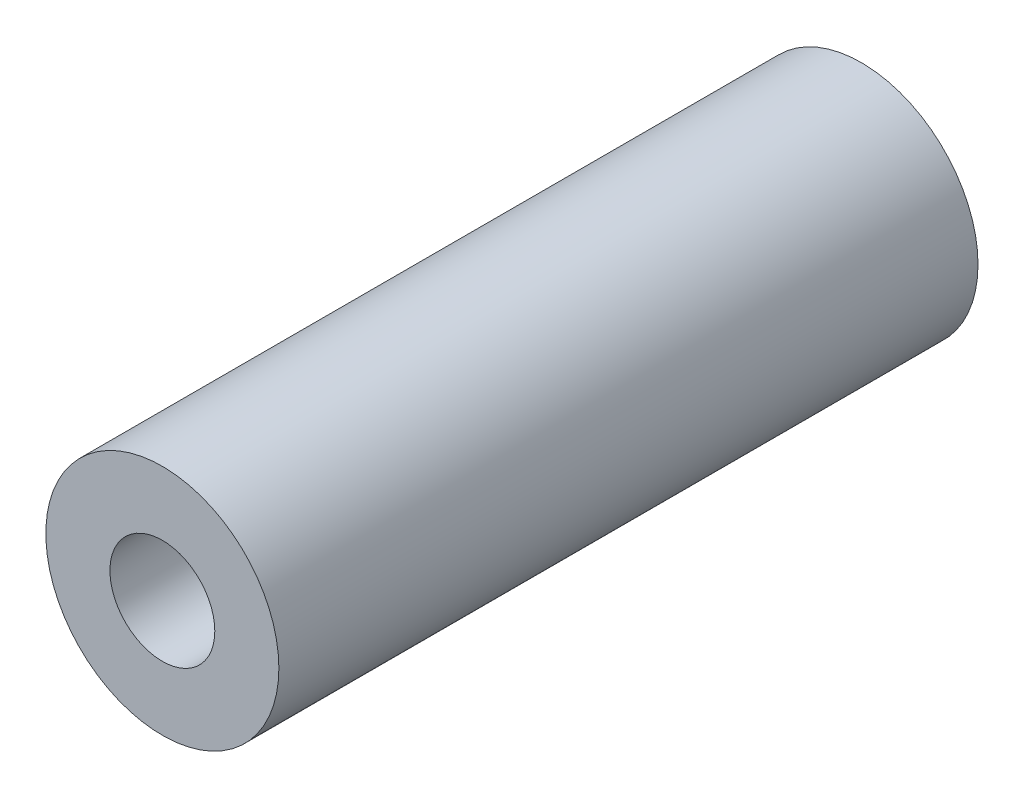
from build123d import *

# Parameters (mm, degrees)
SKETCH_1_R      = 5
SKETCH_1_R_2    = 2.25
EXTRUDE_1_DEPTH = 30


with BuildPart() as part:
    # Эскиз1 → Бобышка-Вытянуть1 (new body)
    with BuildSketch(Plane.XY):
        Circle(SKETCH_1_R)
        Circle(SKETCH_1_R_2, mode=Mode.SUBTRACT)
    extrude(amount=EXTRUDE_1_DEPTH)


solid = part.part
